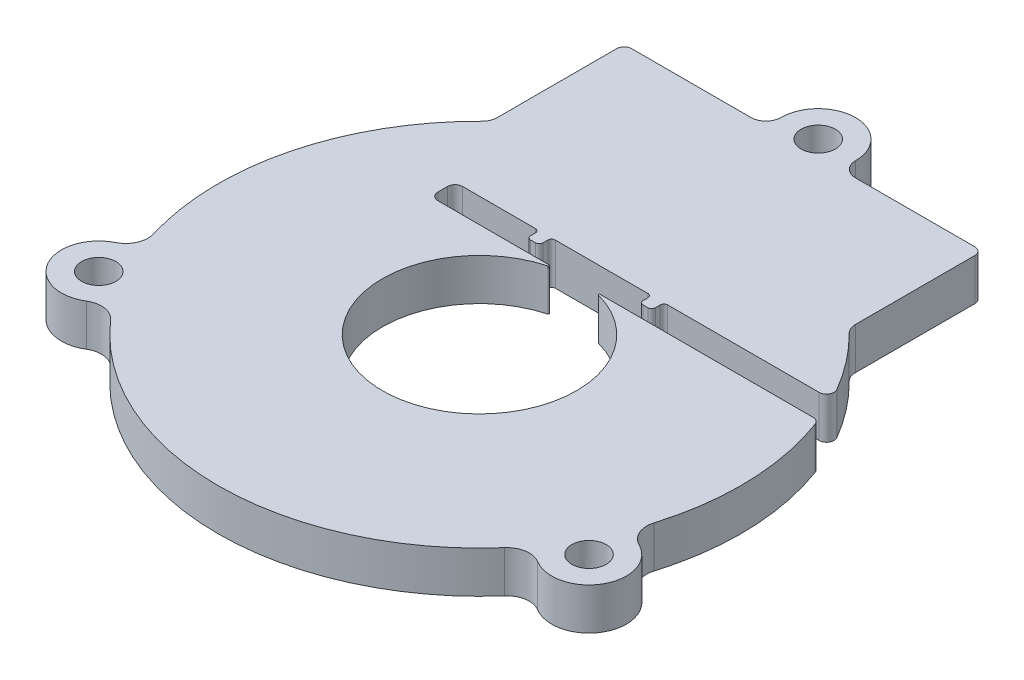
from build123d import *

# Parameters (mm, degrees)
SKETCH1_R                  = 35
SKETCH1_R_2                = 13
SKETCH1_R_3                = 5
SKETCH1_R_4                = 2.3
SKETCH1_W                  = 47.96
SKETCH1_H                  = 25
BOSS_EXTRUDE3_DEPTH        = 5.588
F_4_6_4_6_DIAMETER_HOLE1_D = 4.6
FILLET1_R                  = 3
FILLET2_R                  = 2
FILLET3_R                  = 2
FILLET4_R                  = 1
SKETCH6_W                  = 55.082421743
SKETCH6_H                  = 3.3
CUT_EXTRUDE5_DEPTH         = 10
SKETCH7_W                  = 1.65
SKETCH7_H                  = 1.65
BOSS_EXTRUDE4_DEPTH        = 5.588
FILLET5_R                  = 1
FILLET6_R                  = 0.5
FILLET7_R                  = 0.5
FILLET11_R                 = 1
FILLET13_R                 = 0.1
FILLET14_R                 = 0.1


with BuildPart() as part:
    # Sketch1 → Boss-Extrude3 (new body)
    # profile 1 of 5: a face of its own
    with BuildSketch(Plane(origin=(0, 0, 0), x_dir=(1, 0, 0), z_dir=(0, 1, 0))):
        with Locations((32.785, 23.351471482)):
            Circle(SKETCH1_R)
        with Locations(Location((32.785, 23.351471482, 0), (0, 0, 270))):
            Circle(SKETCH1_R_2, mode=Mode.SUBTRACT)
    # profile 2 of 5: a face of its own
    with BuildSketch(Plane(origin=(0, 0, 0), x_dir=(1, 0, 0), z_dir=(0, 1, 0))):
        with Locations((65.600049901, 5.201471482)):
            Circle(SKETCH1_R_3)
        with Locations(Location((65.600049901, 5.201471482, 0), (0, 0, 270))):
            Circle(SKETCH1_R_4, mode=Mode.SUBTRACT)
    # profile 3 of 5: a face of its own
    with BuildSketch(Plane(origin=(0, 0, 0), x_dir=(1, 0, 0), z_dir=(0, 1, 0))):
        with Locations((-0.030049901, 5.201471482)):
            Circle(SKETCH1_R_3)
        with Locations(Location((-0.030049901, 5.201471482, 0), (0, 0, 270))):
            Circle(SKETCH1_R_4, mode=Mode.SUBTRACT)
    # profile 4 of 5: a face of its own
    with BuildSketch(Plane(origin=(0, 0, 0), x_dir=(1, 0, 0), z_dir=(0, 1, 0))):
        with Locations((32.785, 68.701471482)):
            Circle(SKETCH1_R_3)
    # profile 5 of 5: a face of its own
    with BuildSketch(Plane(origin=(0, 0, 0), x_dir=(1, 0, 0), z_dir=(0, 1, 0))):
        with Locations((32.785, 54.201471482)):
            Rectangle(SKETCH1_W, SKETCH1_H)
    extrude(amount=BOSS_EXTRUDE3_DEPTH)

    # Ø4.6 (4.6) Diameter Hole1 (through all)
    with Locations(Plane(origin=(0, 5.588, 0), x_dir=(1, 0, 0), z_dir=(0, 1, 0))):
        with Locations((32.785, 68.701471482)):
            Hole(F_4_6_4_6_DIAMETER_HOLE1_D / 2)

    # Fillet1
    fillet1_edges = [part.edges().sort_by_distance(p)[0] for p in [
        (65.214711372, 2.794, -10.18660079),
        (61.172514444, 2.794, -2.878342174),
        (0.355288628, 2.794, -10.18660079),
        (4.397485556, 2.794, -2.878342174),
    ]]
    fillet(fillet1_edges, radius=FILLET1_R)

    # Fillet2
    fillet2_edges = [part.edges().sort_by_distance(p)[0] for p in [
        (28.202424305, 2.794, -66.701471482),
        (37.367575695, 2.794, -66.701471482),
    ]]
    fillet(fillet2_edges, radius=FILLET2_R)

    # Fillet3
    fillet3_edges = [part.edges().sort_by_distance(p)[0] for p in [
        (8.805, 2.794, -48.845776728),
        (56.765, 2.794, -48.845776728),
    ]]
    fillet(fillet3_edges, radius=FILLET3_R)

    # Fillet4
    fillet4_edges = [part.edges().sort_by_distance(p)[0] for p in [
        (56.765, 2.794, -66.701471482),
        (8.805, 2.794, -66.701471482),
    ]]
    fillet(fillet4_edges, radius=FILLET4_R)

    # Sketch6 → Cut-Extrude5 (cut)
    with BuildSketch(Plane(origin=(0, 5.588, 0), x_dir=(1, 0, 0), z_dir=(0, 1, 0))):
        with Locations((41.000226715, 37.751471482)):
            Rectangle(SKETCH6_W, SKETCH6_H)
    extrude(amount=-CUT_EXTRUDE5_DEPTH, mode=Mode.SUBTRACT)

    # Sketch7 → Boss-Extrude4 (add)
    with BuildSketch(Plane(origin=(0, 5.588, 0), x_dir=(1, 0, 0), z_dir=(0, 1, 0))):
        with Locations((40.61, 38.576471482)):
            Rectangle(SKETCH7_W, SKETCH7_H)
        with Locations((25.56, 38.576471482)):
            Rectangle(SKETCH7_W, SKETCH7_H)
    extrude(amount=-BOSS_EXTRUDE4_DEPTH)

    # Fillet5
    fillet5_edges = [part.edges().sort_by_distance(p)[0] for p in [
        (13.459015843, 2.794, -36.101471482),
        (13.459015843, 2.794, -39.401471482),
    ]]
    fillet(fillet5_edges, radius=FILLET5_R)

    # Fillet6
    fillet6_edges = [part.edges().sort_by_distance(p)[0] for p in [
        (26.385, 2.794, -39.401471482),
        (24.735, 2.794, -39.401471482),
        (41.435, 2.794, -39.401471482),
        (39.785, 2.794, -39.401471482),
    ]]
    fillet(fillet6_edges, radius=FILLET6_R)

    # Fillet7
    fillet7_edges = [part.edges().sort_by_distance(p)[0] for p in [
        (26.385, 2.794, -37.751471482),
        (24.735, 2.794, -37.751471482),
        (41.435, 2.794, -37.751471482),
        (39.785, 2.794, -37.751471482),
    ]]
    fillet(fillet7_edges, radius=FILLET7_R)

    # Fillet11
    fillet11_edges = [part.edges().sort_by_distance(p)[0] for p in [
        (63.888014323, 2.794, -39.401471482),
        (65.380053306, 2.794, -36.101471482),
    ]]
    fillet(fillet11_edges, radius=FILLET11_R)

    # Fillet13
    fillet13_edges = [part.edges().sort_by_distance(p)[0] for p in [
        (30.247777109, 2.794, -36.101471482),
    ]]
    fillet(fillet13_edges, radius=FILLET13_R)

    # Fillet14
    fillet14_edges = [part.edges().sort_by_distance(p)[0] for p in [
        (35.322222891, 2.794, -36.101471482),
    ]]
    fillet(fillet14_edges, radius=FILLET14_R)


solid = part.part
